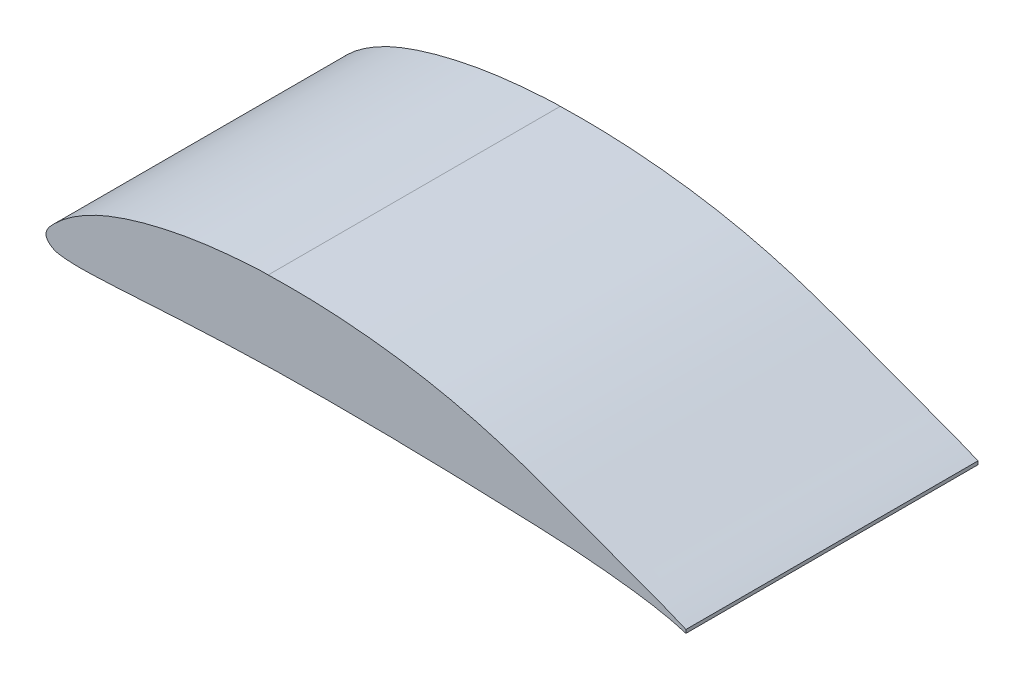
from build123d import *

# Parameters (mm, degrees)
EXTRUDE_1_DEPTH = 200


with BuildPart() as part:
    # 草图2 → 凸台-拉伸1 (new body)
    with BuildSketch(Plane.XY):
        with BuildLine():
            Line((286.055608228, -67.209266366), (286.055608228, -69.532766948))
            add(Edge.make_bspline(
                [(0, 0), (-2.725444694, 0.16479075), (-6.529329099, -0.138331244), (-11.397016018, -0.405348512), (-15.713874629, -0.64444661), (-21.121913216, -1.041627107), (-27.619648691, -1.602920243), (-34.105982036, -2.270964793), (-40.579797503, -3.043587525), (-47.038279723, -3.931652037), (-53.479734263, -4.935955417), (-58.854414584, -5.877356762), (-63.169985024, -6.70024074), (-66.434425741, -7.357914384), (-69.691963936, -8.046339188), (-72.941077321, -8.77256441), (-76.183155264, -9.529979299), (-79.417200801, -10.323559167), (-82.671188627, -11.161789957), (-85.94521275, -12.041440017), (-89.23632109, -12.971017746), (-92.514827659, -13.941881935), (-95.77914161, -14.959856385), (-99.028801968, -16.02419143), (-102.262401726, -17.140269432), (-104.962526081, -18.121694649), (-107.136544699, -18.945165575), (-108.791541193, -19.589414389), (-110.439200679, -20.250087878), (-112.080238251, -20.92601665), (-113.436360447, -21.514562153), (-114.799567501, -22.084744275), (-116.429788539, -22.849639447), (-118.360299468, -23.734628468), (-120.291408253, -24.685432883), (-121.948548066, -25.524658599), (-123.593652926, -26.392003285), (-125.229519218, -27.284016058), (-126.855596581, -28.204859765), (-128.517200827, -29.17741547), (-130.21083081, -30.205442861), (-131.930502415, -31.291558288), (-133.628269536, -32.406389376), (-135.298492236, -33.546499842), (-136.932725116, -34.7128219), (-138.527730347, -35.899250832), (-139.87977025, -36.956117217), (-141.006081118, -37.869529498), (-141.921591236, -38.637405862), (-142.830664323, -39.425208217), (-143.739703161, -40.239219522), (-144.656101653, -41.085997114), (-145.586401749, -41.971657092), (-146.641442979, -43.003756741), (-147.814027187, -44.186443378), (-149.051137738, -45.534471175), (-150.183287122, -46.937773376), (-151.137791588, -48.380311299), (-151.835733309, -49.854011685), (-152.197950673, -51.357874625), (-152.116377567, -52.6851503), (-151.736524949, -53.757901692), (-151.248705518, -54.622813972), (-150.621080517, -55.444995082), (-149.875697311, -56.210818528), (-149.041156237, -56.910942554), (-148.141407974, -57.531735767), (-147.234879227, -58.042067674), (-146.342332479, -58.446578755), (-145.47686329, -58.760343946), (-144.603345187, -59.009285546), (-143.724303936, -59.208245301), (-142.839292945, -59.363577497), (-141.950551403, -59.490451701), (-140.825929854, -59.622495162), (-139.464937172, -59.764274743), (-137.865807953, -59.901840496), (-136.262207013, -60.012543487), (-134.655562674, -60.098283022), (-133.046632135, -60.161490781), (-131.436429613, -60.202280242), (-129.825050101, -60.223598267), (-128.213228638, -60.225210722), (-126.601727435, -60.211439507), (-124.991342664, -60.182816005), (-123.381767087, -60.144170461), (-121.772547624, -60.094255948), (-120.163299382, -60.039622339), (-118.553272856, -59.97874382), (-116.405135775, -59.897052051), (-114.25630744, -59.809563299), (-112.107687845, -59.718305361), (-110.496074249, -59.646015596), (-108.884224596, -59.573015661), (-106.733902854, -59.468520942), (-104.045134479, -59.333058566), (-100.818867527, -59.158040382), (-97.593531503, -58.974317976), (-94.368955004, -58.783136756), (-91.144489426, -58.588261445), (-87.919549107, -58.391747611), (-84.694353955, -58.193400641), (-81.468682834, -57.998554673), (-78.243570418, -57.803396432), (-75.018468811, -57.612070176), (-71.793569138, -57.423092565), (-68.568002165, -57.239451184), (-65.342134172, -57.055873416), (-60.889689655, -56.811968085), (-50.4823717, -56.256797171), (-39.738024807, -55.760868752), (-29.145608314, -55.318080066), (-23.436100514, -55.100144163), (-16.989096881, -54.871193717), (-10.544531059, -54.66752336), (-5.216141596, -54.511600586), (24.816205374, -53.75116662), (54.864063261, -53.785828636), (86.007749154, -54.171705504), (92.437398561, -54.267447737), (98.866042453, -54.377966038), (104.734565572, -54.492454463), (115.492942115, -54.724826001), (126.206565517, -55.000515422), (137.477971799, -55.333491378), (143.859380276, -55.531056564), (149.213526009, -55.702096911), (153.497044422, -55.845713453), (156.069039561, -55.929977897), (159.282488984, -56.03977671), (163.567567314, -56.184372648), (169.564265612, -56.392746778), (175.989918576, -56.62458583), (182.413470777, -56.87486903), (188.835284325, -57.150500523), (195.255523834, -57.455959443), (201.674688689, -57.802575463), (208.095271976, -58.19482851), (214.515615191, -58.640093564), (220.933950248, -59.145085891), (227.347072378, -59.706320062), (233.754357613, -60.33612596), (240.156440818, -61.030450763), (246.55286602, -61.79900368), (251.884892916, -62.503528456), (256.155563709, -63.106980732), (259.366061645, -63.58860377), (262.570233843, -64.102835954), (265.766684956, -64.655259055), (268.953024845, -65.255025736), (272.128277639, -65.907077835), (275.311127883, -66.622757601), (278.499849813, -67.406872411), (282.09048433, -68.371672385), (284.615229937, -69.061847319), (286.055608228, -69.532766948)],
                knots=[0, 0, 0, 0, 0.013429266, 0.018716729, 0.024004191, 0.034706079, 0.045405056, 0.05610273, 0.066797979, 0.077492536, 0.088187468, 0.098882888, 0.104346572, 0.10981022, 0.115272402, 0.120733356, 0.126196006, 0.131658689, 0.137122536, 0.142734056, 0.148343908, 0.153954022, 0.159562374, 0.165172765, 0.170783601, 0.176398138, 0.179312148, 0.182225445, 0.185138958, 0.188049197, 0.190960188, 0.192414974, 0.195321254, 0.199821328, 0.202867385, 0.205914523, 0.208963571, 0.212020289, 0.215084818, 0.218160637, 0.221495947, 0.224835492, 0.22817077, 0.231492007, 0.234787969, 0.238051825, 0.241275187, 0.243233433, 0.245188895, 0.247155989, 0.249153783, 0.251194383, 0.25329682, 0.255475443, 0.258458465, 0.261492958, 0.264476844, 0.267324326, 0.269987635, 0.272465074, 0.274860746, 0.276409009, 0.278031414, 0.279729108, 0.281486084, 0.28328071, 0.285082355, 0.286858664, 0.288393505, 0.289900318, 0.291385352, 0.292861116, 0.294334247, 0.295806564, 0.297279135, 0.299907183, 0.302541073, 0.30517838, 0.30781824, 0.310459636, 0.313103075, 0.315745669, 0.318391033, 0.321035997, 0.323677343, 0.326318213, 0.328960244, 0.331601385, 0.334243176, 0.336890139, 0.342181748, 0.34482804, 0.347474762, 0.350121774, 0.35276938, 0.358070712, 0.36337214, 0.368671762, 0.373970917, 0.379270748, 0.384570921, 0.389872896, 0.39517453, 0.400475993, 0.405775316, 0.411075767, 0.416375555, 0.421676645, 0.426978555, 0.438322481, 0.472972246, 0.479915504, 0.490501855, 0.501093745, 0.511666367, 0.522236565, 0.527330213, 0.659527064, 0.670077962, 0.680626484, 0.691175966, 0.701723186, 0.70951569, 0.744138977, 0.754470581, 0.765015594, 0.775562088, 0.780836092, 0.786110096, 0.788227744, 0.796661303, 0.807212434, 0.817760151, 0.828307694, 0.838851851, 0.849396098, 0.859942466, 0.87049153, 0.881055602, 0.891617635, 0.902178563, 0.91273989, 0.923304472, 0.933872558, 0.944447572, 0.949775125, 0.955100631, 0.960425594, 0.965746938, 0.971065681, 0.976382904, 0.981700186, 0.98712133, 0.992543081, 1, 1, 1, 1], degree=3))
            add(Edge.make_bspline(
                [(0, 0), (3.712392232, 0.037127334), (9.570522066, 0.186052889), (17.577599083, 0.200126776), (24.019331444, 0.134254504), (30.457474332, -0.015719002), (36.890458068, -0.244055135), (43.316233695, -0.553304169), (49.736640637, -0.939479239), (56.15160193, -1.404040156), (62.561185069, -1.945375189), (68.96550657, -2.562132424), (75.376371972, -3.256796096), (81.791827945, -4.026562677), (88.209809749, -4.87613039), (94.615506116, -5.805295025), (101.007785919, -6.820773201), (107.386282088, -7.918704488), (113.749672512, -9.107213058), (120.131390676, -10.395283622), (126.529144262, -11.784264987), (132.939676049, -13.276922811), (139.327053916, -14.862297703), (145.68897099, -16.544874515), (150.974926486, -18.006068596), (155.066777624, -19.22726589), (158.736648193, -20.291488778), (161.874049685, -21.285002204), (166.22583865, -22.623839086), (170.186568218, -23.919973411), (174.259554435, -25.311482978), (176.607497155, -26.099380522), (179.560051762, -27.121665131), (183.961366382, -28.658371966), (190.065615766, -30.858949911), (196.378289161, -33.176735586), (202.681199965, -35.525199799), (208.989812562, -37.894863302), (215.306391481, -40.274601471), (221.63236241, -42.658373138), (227.956938485, -45.040508925), (234.283971005, -47.415332102), (240.614746748, -49.780972664), (246.951126246, -52.136508839), (252.239434164, -54.082740818), (256.474382905, -55.630992907), (259.650155279, -56.793515297), (262.824387684, -57.95851836), (265.9936918, -59.136276991), (269.156931358, -60.329386909), (272.312196321, -61.543783056), (275.474642785, -62.790366989), (278.640882203, -64.076687559), (282.175461463, -65.54729581), (284.644285935, -66.597802105), (286.055608228, -67.209266366)],
                knots=[0, 0, 0, 0, 0.037573429, 0.059301976, 0.081032744, 0.102769573, 0.12447556, 0.146177671, 0.167875775, 0.189569695, 0.21126923, 0.232973941, 0.254683492, 0.276529249, 0.298366286, 0.320202187, 0.342035227, 0.363869225, 0.385703683, 0.407547795, 0.429756109, 0.451958557, 0.474159379, 0.496358654, 0.518557735, 0.529658291, 0.539575049, 0.557227985, 0.56296214, 0.58565501, 0.599399807, 0.606522912, 0.610719484, 0.631021678, 0.653703331, 0.676388892, 0.699079663, 0.721776358, 0.744591324, 0.767393466, 0.790193509, 0.812989421, 0.835788768, 0.858591699, 0.881404984, 0.892818858, 0.9042263, 0.915631404, 0.92703924, 0.938444543, 0.949846564, 0.961255583, 0.972846621, 0.984433654, 1, 1, 1, 1], degree=3))
        make_face()
    extrude(amount=EXTRUDE_1_DEPTH)


solid = part.part
